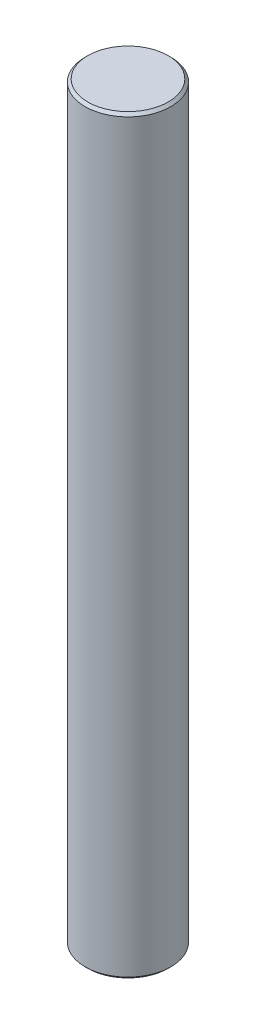
from build123d import *

# Parameters (mm, degrees)
SKETCH1_R           = 4
BOSS_EXTRUDE1_DEPTH = 70
CHAMFER1_SIZE       = 0.25


with BuildPart() as part:
    # Sketch1 → Boss-Extrude1 (new body)
    with BuildSketch(Plane(origin=(0, 0, 0), x_dir=(1, 0, 0), z_dir=(0, 1, 0))):
        with Locations(Location((0, 0, 0), (0, 0, 270))):
            Circle(SKETCH1_R)
    extrude(amount=BOSS_EXTRUDE1_DEPTH)

    # Chamfer1
    chamfer1_edges = [part.edges().sort_by_distance(p)[0] for p in [
        (0, 0, -4),
        (0, 70, -4),
    ]]
    chamfer(chamfer1_edges, length=CHAMFER1_SIZE)


solid = part.part
